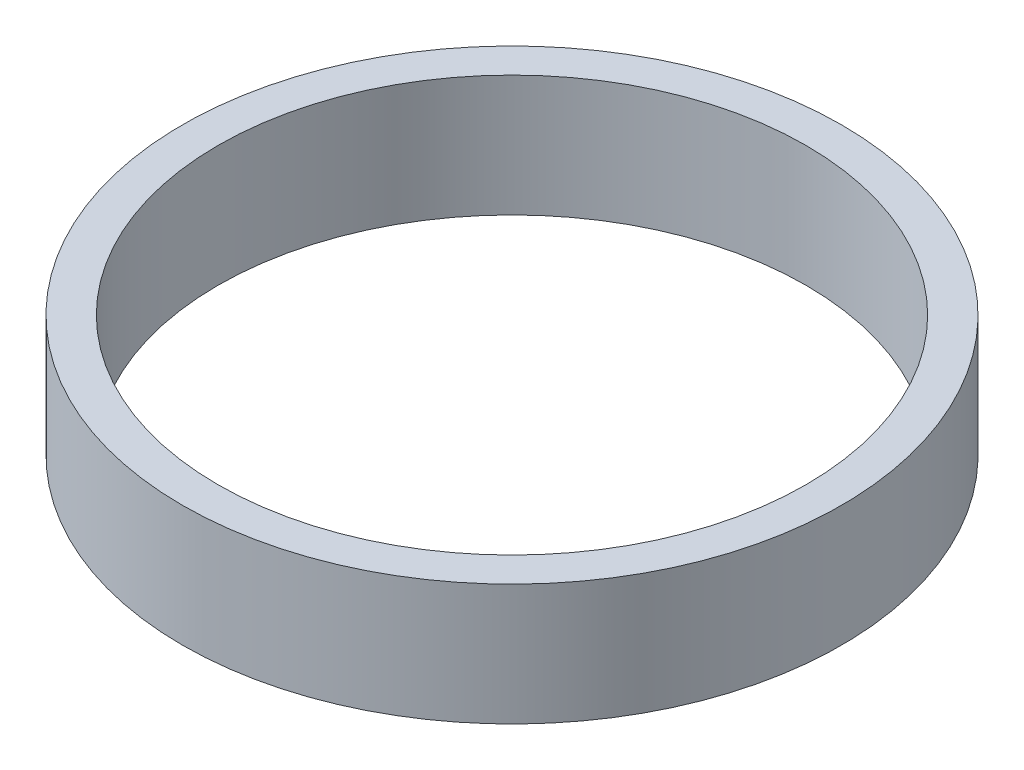
from build123d import *

# Parameters (mm, degrees)
SKETCH1_R           = 4.625
SKETCH1_R_2         = 4.125
BOSS_EXTRUDE1_DEPTH = 1.7


with BuildPart() as part:
    # Sketch1 → Boss-Extrude1 (new body)
    with BuildSketch(Plane(origin=(0, 0, 0), x_dir=(1, 0, 0), z_dir=(0, 1, 0))):
        with Locations(Location((0, 0, 0), (0, 0, 270))):
            Circle(SKETCH1_R)
        with Locations(Location((0, 0, 0), (0, 0, 270))):
            Circle(SKETCH1_R_2, mode=Mode.SUBTRACT)
    extrude(amount=BOSS_EXTRUDE1_DEPTH)


solid = part.part
